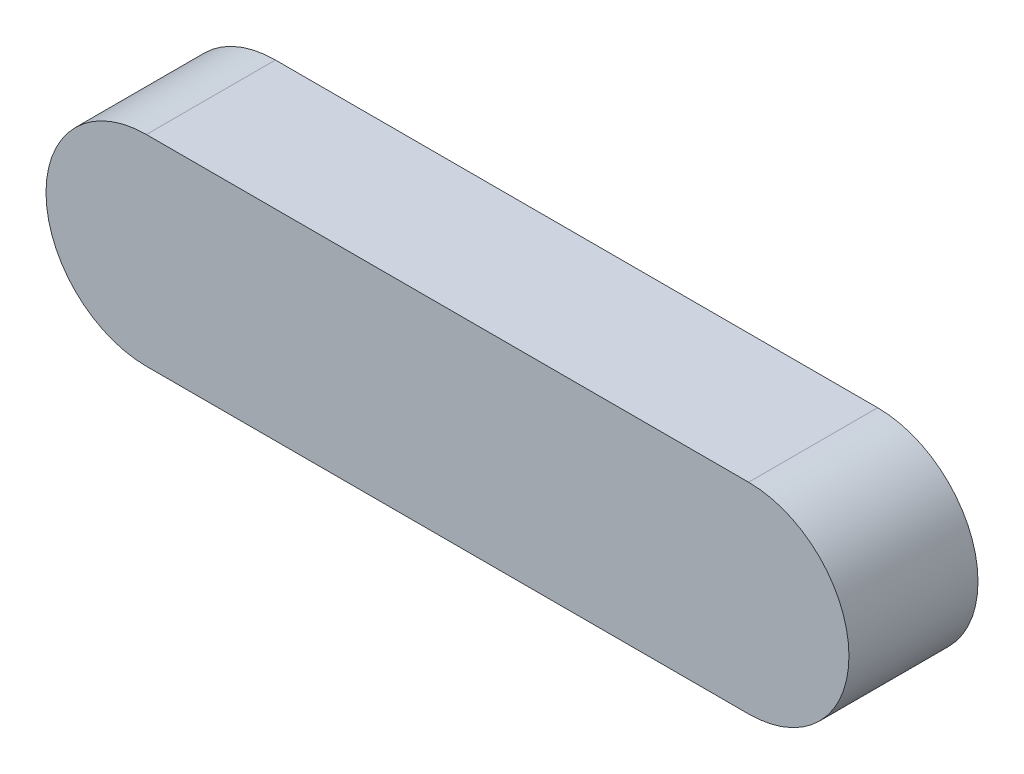
from build123d import *

# Parameters (mm, degrees)
EXTRUDE1_DEPTH = 9


with BuildPart() as part:
    # Sketch1 → Extrude1 (new body)
    with BuildSketch(Plane.XY):
        with BuildLine():
            Line((-21, 7), (21, 7))
            ThreePointArc((21, 7), (28, 0), (21, -7))
            Line((21, -7), (-21, -7))
            ThreePointArc((-21, -7), (-28, 0), (-21, 7))
        make_face()
    extrude(amount=EXTRUDE1_DEPTH)


solid = part.part
